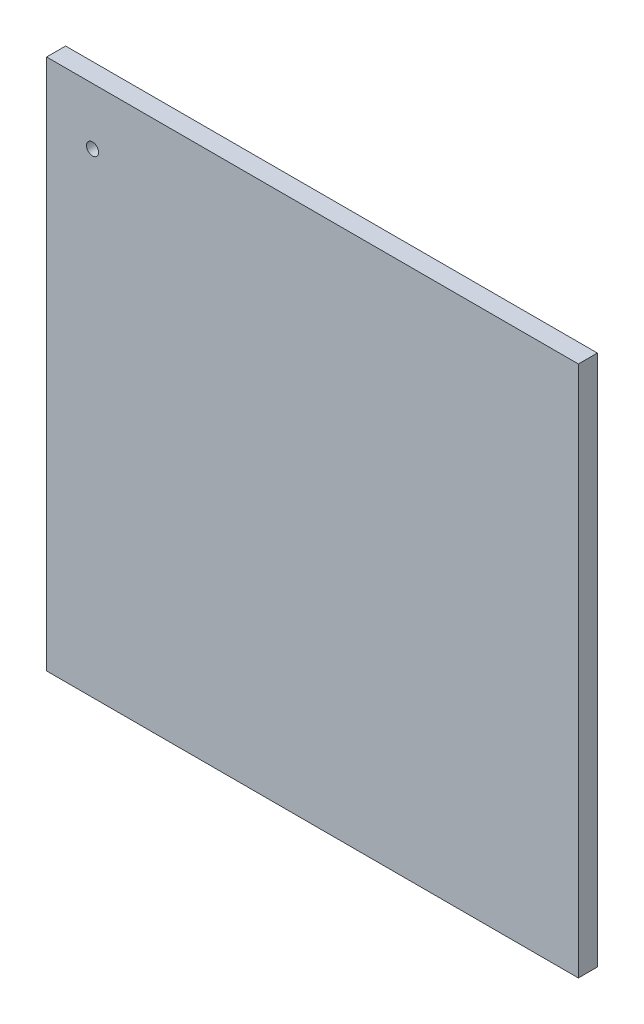
from build123d import *

# Parameters (mm, degrees)
SKETCH_1_W          = 140
SKETCH_1_H          = 140
EXTRUDE_1_DEPTH     = 5
SKETCH_2_R          = 1.6
CUT_EXTRUDE_1_DEPTH = 100.121138008


with BuildPart() as part:
    # 草图1 → 凸台-拉伸1 (new body)
    with BuildSketch(Plane.XY):
        Rectangle(SKETCH_1_W, SKETCH_1_H)
    extrude(amount=EXTRUDE_1_DEPTH)

    # 草图2 → 切除-拉伸1 (cut, through all)
    with BuildSketch(Plane.XY.offset(5)):
        with Locations((-57.91, 55.075)):
            Circle(SKETCH_2_R)
    extrude(amount=-CUT_EXTRUDE_1_DEPTH, mode=Mode.SUBTRACT)


solid = part.part
